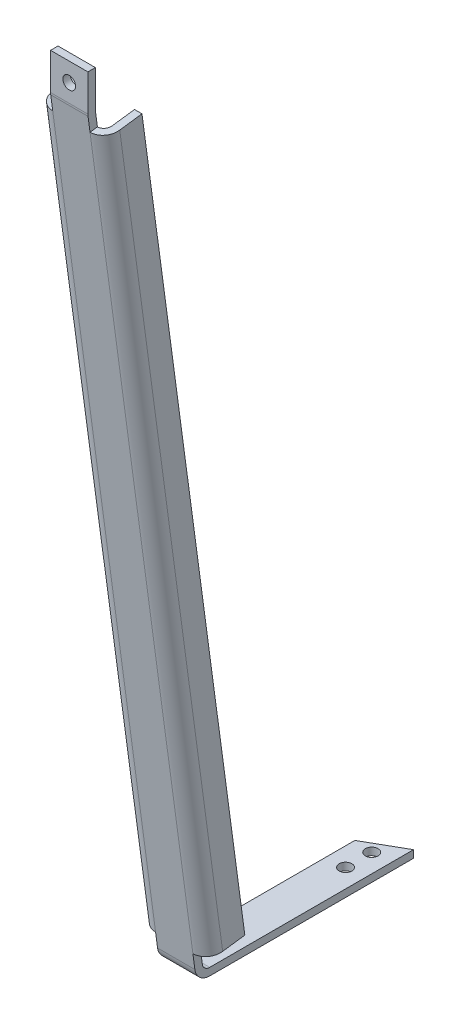
from build123d import *

# Parameters (mm, degrees)
FORMED_WEB_DEPTH           = 10
EDGE_STIFFENING_LIPS_DEPTH = 206.123068282
WALL_MOUNT_HOLE_SKETCH_R   = 1.7
WALL_MOUNT_HOLES_DEPTH     = 2.4
COVER_MOUNT_HOLE_SKETCH_R  = 1.7
COVER_MOUNT_HOLE_DEPTH     = 2.4
LOWER_EDGE_CLEARANCE_DEPTH = 2.4


with BuildPart() as part:
    # Formed Web Section Sketch → Formed Web (new body)
    with BuildSketch(Plane(origin=(-260, 0, 0), x_dir=(0, 0, -1), z_dir=(1, 0, 0))):
        with BuildLine():
            Line((-22, 64), (-77.377483747, 64))
            ThreePointArc((-77.377483747, 64), (-80.010089753, 64.988457933), (-81.341585612, 67.46530719))
            Line((-81.341585612, 67.46530719), (-109.964101865, 279.66672079))
            ThreePointArc((-109.964101865, 279.66672079), (-109.991015376, 279.933465342), (-110, 280.2014136))
            Line((-110, 280.2014136), (-110, 290))
            Line((-110, 290), (-108, 290))
            Line((-108, 290), (-108, 280.2014136))
            ThreePointArc((-108, 280.2014136), (-107.995507688, 280.067439471), (-107.982050933, 279.934067195))
            Line((-107.982050933, 279.934067195), (-79.35953468, 67.732653595))
            ThreePointArc((-79.35953468, 67.732653595), (-78.69378675, 66.494228967), (-77.377483747, 66))
            Line((-77.377483747, 66), (-22, 66))
            Line((-22, 66), (-22, 64))
        make_face()
    extrude(amount=FORMED_WEB_DEPTH)

    # Edge Lip Sketch → Edge Stiffening Lips (add)
    with BuildSketch(Plane(origin=(0, 80.999511953, 10.925515566), x_dir=(-1, 0, 0), z_dir=(0, -0.9910254663478989, -0.1336732024376229))):
        with BuildLine():
            Line((264, -67.593279149), (264, -61.593279149))
            Line((264, -61.593279149), (262, -61.593279149))
            Line((262, -61.593279149), (262, -67.593279149))
            ThreePointArc((262, -67.593279149), (261.414213562, -69.007492712), (260, -69.593279149))
            Line((260, -69.593279149), (259.9, -69.593279149))
            Line((259.9, -69.593279149), (259.9, -71.593279149))
            Line((259.9, -71.593279149), (260, -71.593279149))
            ThreePointArc((260, -71.593279149), (262.828427125, -70.421706274), (264, -67.593279149))
        make_face()
        with BuildLine():
            Line((246, -67.593279149), (246, -61.593279149))
            Line((246, -61.593279149), (248, -61.593279149))
            Line((248, -61.593279149), (248, -67.593279149))
            ThreePointArc((248, -67.593279149), (248.585786438, -69.007492712), (250, -69.593279149))
            Line((250, -69.593279149), (250.1, -69.593279149))
            Line((250.1, -69.593279149), (250.1, -71.593279149))
            Line((250.1, -71.593279149), (250, -71.593279149))
            ThreePointArc((250, -71.593279149), (247.171572875, -70.421706274), (246, -67.593279149))
        make_face()
    extrude(amount=-EDGE_STIFFENING_LIPS_DEPTH)

    # Wall Mount Hole Sketch → Wall Mount Holes (cut)
    with BuildSketch(Plane(origin=(0, 63.8, 0), x_dir=(-1, 0, 0), z_dir=(0, -1, 0))):
        with Locations(Location((255, -29, 0), (0, 0, 90))):
            Circle(WALL_MOUNT_HOLE_SKETCH_R)
        with Locations(Location((255, -36, 0), (0, 0, 90))):
            Circle(WALL_MOUNT_HOLE_SKETCH_R)
    extrude(amount=-WALL_MOUNT_HOLES_DEPTH, mode=Mode.SUBTRACT)

    # Cover Mount Hole Sketch → Cover Mount Hole (cut)
    with BuildSketch(Plane.XY.offset(107.8)):
        with Locations(Location((-255, 285, 0), (0, 0, 90))):
            Circle(COVER_MOUNT_HOLE_SKETCH_R)
    extrude(amount=COVER_MOUNT_HOLE_DEPTH, mode=Mode.SUBTRACT)

    # Lower Edge Clearance Sketch → Lower Edge Clearance (cut)
    with BuildSketch(Plane(origin=(0, 63.8, 0), x_dir=(-1, 0, 0), z_dir=(0, -1, 0))):
        Polygon((261, -20), (249, -20), (249, -22.23), (261, -29.07), align=None)
    extrude(amount=-LOWER_EDGE_CLEARANCE_DEPTH, mode=Mode.SUBTRACT)


solid = part.part
